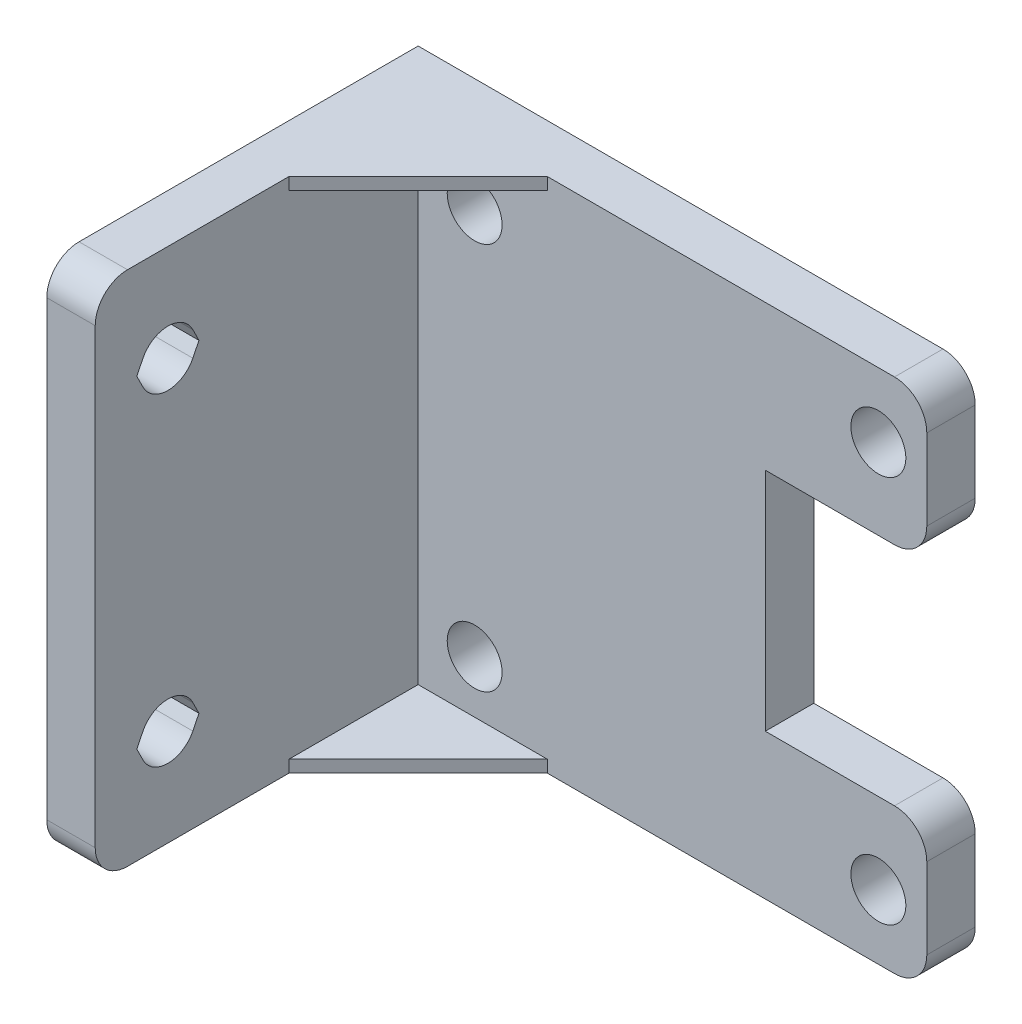
from build123d import *

# Parameters (mm, degrees)
BOSS_EXTRUDE1_DEPTH             = 3
M3_CLEARANCE_HOLE1_D            = 3.4
M3_CLEARANCE_HOLE1_CSINK_D      = 3.45
M3_CLEARANCE_HOLE1_CSINK_ANGLE  = 90
SKETCH7_W                       = 3
SKETCH7_H                       = 32
BOSS_EXTRUDE2_DEPTH             = 20
BOSS_EXTRUDE2_DIRECTION_2_REACH = 45.943
M3_CLEARANCE_HOLE2_D            = 3.4
M3_CLEARANCE_HOLE2_CSINK_D      = 3.45
M3_CLEARANCE_HOLE2_CSINK_ANGLE  = 90
FILLET1_R                       = 2
RIB1_REACH                      = 52.45
SKETCH11_WALL_W                 = 114.21465002
SKETCH11_WALL_H                 = 0.75
SKETCH12_R                      = 1.725
CUT_EXTRUDE1_DEPTH              = 50.822183814


with BuildPart() as part:
    # Sketch2 → Boss-Extrude1 (new body)
    with BuildSketch(Plane.XY):
        Polygon((3, 31), (-31, 31), (-31, -1), (3, -1), (3, 8), (-7, 8), (-7, 22), (3, 22), align=None)
    extrude(amount=BOSS_EXTRUDE1_DEPTH)

    # M3 Clearance Hole1 (through all)
    with Locations(Plane(origin=(0, 0, 0), x_dir=(-1, 0, 0), z_dir=(0, 0, -1))):
        with Locations((25, 3), (25, 27), (0, 27), (0, 3)):
            CounterSinkHole(M3_CLEARANCE_HOLE1_D / 2, M3_CLEARANCE_HOLE1_CSINK_D / 2, counter_sink_angle=M3_CLEARANCE_HOLE1_CSINK_ANGLE)

    # Sketch7 → Boss-Extrude2 (add)
    with BuildSketch(Plane.XY.offset(3)):
        with Locations((-30, 15)):
            Rectangle(SKETCH7_W, SKETCH7_H)
    extrude(amount=BOSS_EXTRUDE2_DEPTH)

    # Boss-Extrude2 direction 2: up to this face of the body (flat: up to its plane)
    boss_extrude2_direction_2_end = Plane(part.part.faces().sort_by_distance((-15.906518225, 15, 0))[0])
    # Sketch7 → Boss-Extrude2 direction 2 (add, up to the picked face)
    with BuildSketch(Plane.XY.offset(3), mode=Mode.PRIVATE) as boss_extrude2_direction_2_sk1:
        with Locations((-30, 15)):
            Rectangle(SKETCH7_W, SKETCH7_H)
    boss_extrude2_direction_2_tool1 = split(extrude(boss_extrude2_direction_2_sk1.sketch, amount=-BOSS_EXTRUDE2_DIRECTION_2_REACH, mode=Mode.PRIVATE), bisect_by=boss_extrude2_direction_2_end, keep=Keep.BOTH, mode=Mode.PRIVATE)
    add(boss_extrude2_direction_2_tool1.solids().sort_by(Axis((-30, 15, 3), (0, 0, -1)))[0])

    # M3 Clearance Hole2 (through all)
    with Locations(Plane(origin=(-28.5, 27.5, 0), x_dir=(0, -1, 0), z_dir=(1, 0, 0))):
        with Locations((22.5, -18.5), (2.5, -18.5)):
            CounterSinkHole(M3_CLEARANCE_HOLE2_D / 2, M3_CLEARANCE_HOLE2_CSINK_D / 2, counter_sink_angle=M3_CLEARANCE_HOLE2_CSINK_ANGLE)

    # Fillet1
    fillet1_edges = [part.edges().sort_by_distance(p)[0] for p in [
        (3, 8, 1.5),
        (3, -1, 1.5),
        (3, 31, 1.5),
        (3, 22, 1.5),
        (-30, 31, 23),
        (-30, -1, 23),
    ]]
    fillet(fillet1_edges, radius=FILLET1_R)

    # Sketch11 wall → Rib1 (add, up to next)
    with BuildSketch(Plane(origin=(-24.5, -1, 7), x_dir=(0.707106781187, 0, -0.707106781187), z_dir=(0.707106781187, 0, 0.707106781187)), mode=Mode.PRIVATE) as rib1_sk1:
        with Locations((0, 0.375)):
            Rectangle(SKETCH11_WALL_W, SKETCH11_WALL_H)
    rib1_tool1 = extrude(rib1_sk1.sketch, amount=-RIB1_REACH, mode=Mode.PRIVATE) - part.part
    rib1 = rib1_tool1.solids().sort_by_distance((-24.5, -1, 7))[0]
    add(rib1)

    # Mirror1: Rib1 across plane
    add(rib1.mirror(Plane.ZX.offset(15)))

    # Sketch12 → Cut-Extrude1 (cut, through all)
    with BuildSketch(Plane(origin=(-28.5, 0, 0), x_dir=(0, 0, -1), z_dir=(1, 0, 0))):
        with BuildLine():
            Line((-20.425, 5), (-20.045779221, 4.234368496))
            ThreePointArc((-20.045779221, 4.234368496), (-20.225, 5), (-20.045779221, 5.765631504))
            Line((-20.045779221, 5.765631504), (-20.425, 5))
        make_face()
        with BuildLine():
            ThreePointArc((-16.775, 5), (-16.820402704, 4.606836011), (-16.954220779, 4.234368496))
            Line((-16.954220779, 4.234368496), (-16.575, 5))
            Line((-16.575, 5), (-16.954220779, 5.765631504))
            ThreePointArc((-16.954220779, 5.765631504), (-16.820402704, 5.393163989), (-16.775, 5))
        make_face()
        with BuildLine():
            ThreePointArc((-16.775, 25), (-16.820402704, 24.606836011), (-16.954220779, 24.234368496))
            Line((-16.954220779, 24.234368496), (-16.575, 25))
            Line((-16.575, 25), (-16.954220779, 25.765631504))
            ThreePointArc((-16.954220779, 25.765631504), (-16.820402704, 25.393163989), (-16.775, 25))
        make_face()
        with BuildLine():
            Line((-20.425, 25), (-20.045779221, 24.234368496))
            ThreePointArc((-20.045779221, 24.234368496), (-20.225, 25), (-20.045779221, 25.765631504))
            Line((-20.045779221, 25.765631504), (-20.425, 25))
        make_face()
        with Locations((-18.5, 25)):
            Circle(SKETCH12_R)
        with BuildLine():
            ThreePointArc((-20.045779221, 5.765631504), (-20.225, 5), (-20.045779221, 4.234368496))
            ThreePointArc((-20.045779221, 4.234368496), (-19.409645715, 3.534336439), (-18.5, 3.275))
            Line((-18.5, 3.275), (-18.5, 6.725))
            ThreePointArc((-18.5, 6.725), (-19.409645715, 6.465663561), (-20.045779221, 5.765631504))
        make_face()
        with BuildLine():
            Line((-18.5, 6.725), (-18.5, 3.275))
            ThreePointArc((-18.5, 3.275), (-17.590354285, 3.534336439), (-16.954220779, 4.234368496))
            ThreePointArc((-16.954220779, 4.234368496), (-16.820402704, 4.606836011), (-16.775, 5))
            ThreePointArc((-16.775, 5), (-16.820402704, 5.393163989), (-16.954220779, 5.765631504))
            ThreePointArc((-16.954220779, 5.765631504), (-17.590354285, 6.465663561), (-18.5, 6.725))
        make_face()
    extrude(amount=-CUT_EXTRUDE1_DEPTH, mode=Mode.SUBTRACT)


solid = part.part
